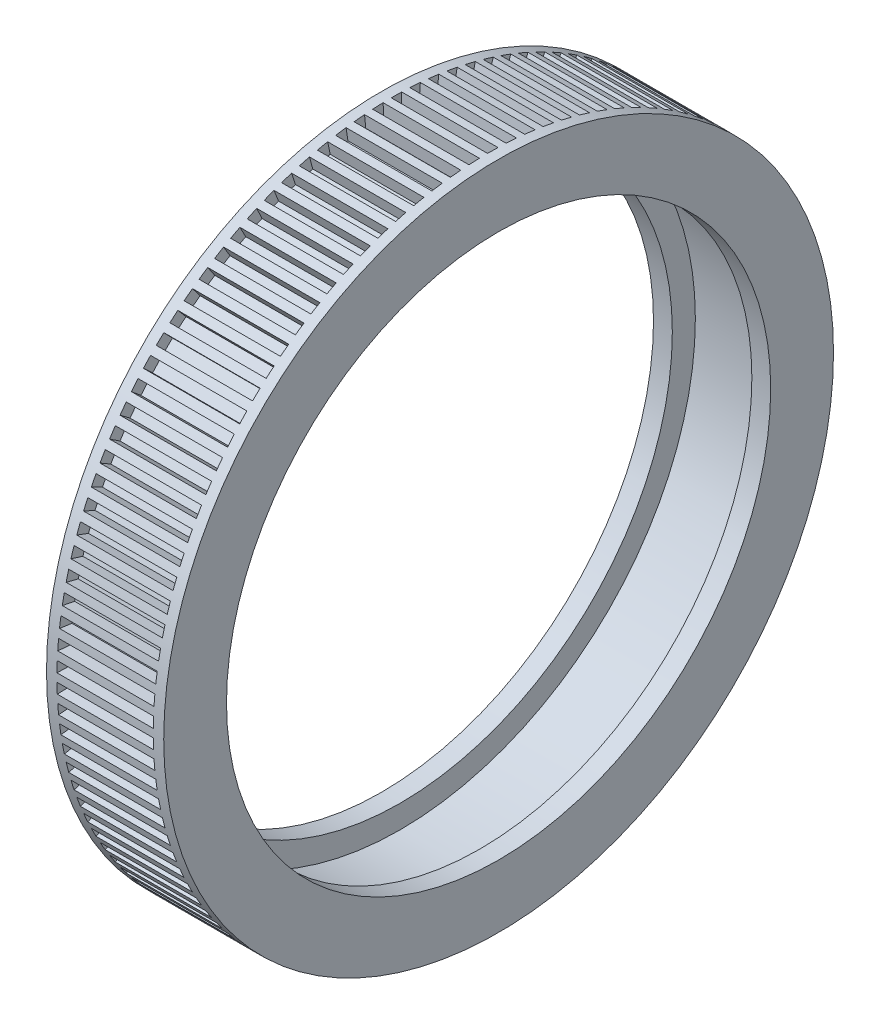
from build123d import *

# Parameters (mm, degrees)
ODEBRAT_START            = -15.4
SKICA2_W                 = 4.6
SKICA2_H                 = 0.5
ODEBRAT_VYSUNUT_M1_DEPTH = 0.7
KRUHOV_POLE1_COUNT       = 113


with BuildPart() as part:
    # Skica1 → Rotovat1 (revolve)
    with BuildSketch(Plane.XY, mode=Mode.PRIVATE) as rotovat1_sk:
        Polygon((2.8, 16), (-2.8, 16), (-2.8, 13), (-1.9, 13), (-1.9, 14.1), (1.9, 14.1), (1.9, 13), (2.8, 13), align=None)
    revolve(rotovat1_sk.sketch.rotate(Axis((-7.577433029, 0, 0), (1, 0, 0)), 90), axis=Axis((-7.577433029, 0, 0), (1, 0, 0)))

    # Skica2 → Odebrat vysunutím1 (cut)
    with BuildSketch(Plane.XY.offset(ODEBRAT_START)):
        Rectangle(SKICA2_W, SKICA2_H)
    odebrat_vysunut_m1 = extrude(amount=-ODEBRAT_VYSUNUT_M1_DEPTH, mode=Mode.SUBTRACT)

    # Kruhové pole1: Odebrat vysunutím1 ×113 about axis
    kruhov_pole1_axis = Axis((0, 0, 0), (1, 0, 0))
    for i in range(1, KRUHOV_POLE1_COUNT):
        add(odebrat_vysunut_m1.rotate(kruhov_pole1_axis, i * 360 / KRUHOV_POLE1_COUNT), mode=Mode.SUBTRACT)


solid = part.part
